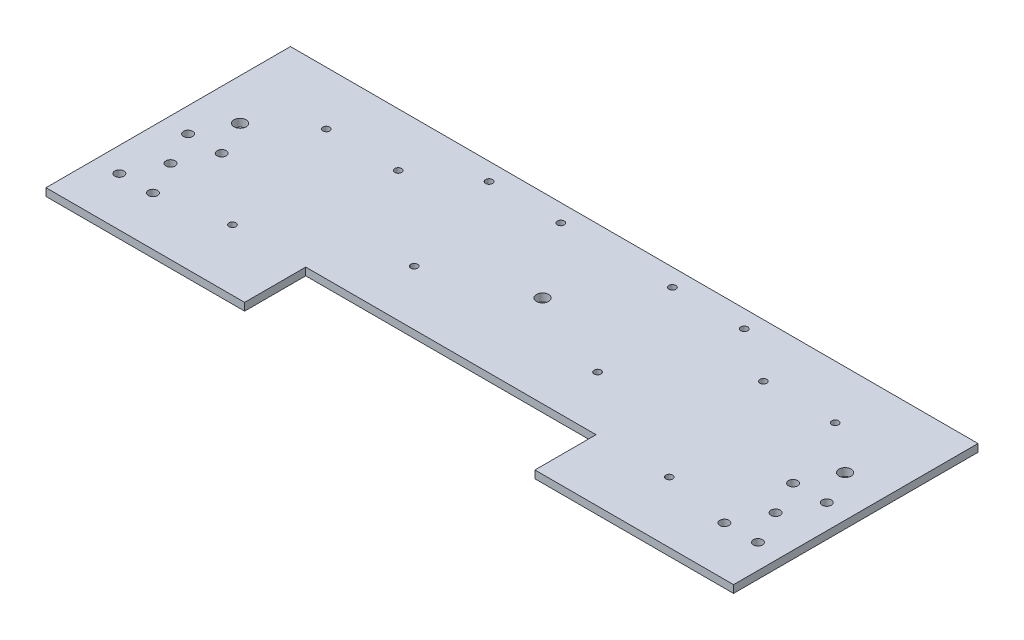
from build123d import *

# Parameters (mm, degrees)
SKETCH_1_W          = 450
SKETCH_1_H          = 120
EXTRUDE_1_DEPTH     = 5
SKETCH_2_R          = 4
CUT_EXTRUDE_1_DEPTH = 466.752079974
SKETCH_3_R          = 2.25
CUT_EXTRUDE_2_DEPTH = 466.752079974
SKETCH_4_W          = 130
SKETCH_4_H          = 40
EXTRUDE_2_DEPTH     = 5
SKETCH_5_R          = 2.25
CUT_EXTRUDE_3_DEPTH = 466.752079974
SKETCH_7_R          = 3
CUT_EXTRUDE_4_DEPTH = 466.752079974


with BuildPart() as part:
    # 草图1 → 凸台-拉伸1 (new body)
    with BuildSketch(Plane(origin=(0, 0, 0), x_dir=(1, 0, 0), z_dir=(0, 1, 0))):
        with Locations((225, 60)):
            Rectangle(SKETCH_1_W, SKETCH_1_H)
    extrude(amount=EXTRUDE_1_DEPTH)

    # 草图2 → 切除-拉伸1 (cut, through all)
    with BuildSketch(Plane(origin=(0, 5, 0), x_dir=(1, 0, 0), z_dir=(0, 1, 0))):
        with Locations(Location((225, 60, 0), (0, 0, 270))):
            Circle(SKETCH_2_R)
        with Locations(Location((27, 60, 0), (0, 0, 270))):
            Circle(SKETCH_2_R)
        with Locations(Location((423, 60, 0), (0, 0, 90))):
            Circle(SKETCH_2_R)
    extrude(amount=-CUT_EXTRUDE_1_DEPTH, mode=Mode.SUBTRACT)

    # 草图3 → 切除-拉伸2 (cut, through all)
    with BuildSketch(Plane(origin=(0, 5, 0), x_dir=(1, 0, 0), z_dir=(0, 1, 0))):
        with Locations(Location((165, 36, 0), (0, 0, 270))):
            Circle(SKETCH_3_R)
        with Locations(Location((141.5, 108.5, 0), (0, 0, 270))):
            Circle(SKETCH_3_R)
        with Locations(Location((188.5, 108.5, 0), (0, 0, 90))):
            Circle(SKETCH_3_R)
        with Locations(Location((285, 36, 0), (0, 0, 90))):
            Circle(SKETCH_3_R)
        with Locations(Location((261.5, 108.5, 0), (0, 0, 270))):
            Circle(SKETCH_3_R)
        with Locations(Location((308.5, 108.5, 0), (0, 0, 90))):
            Circle(SKETCH_3_R)
    extrude(amount=-CUT_EXTRUDE_2_DEPTH, mode=Mode.SUBTRACT)

    # 草图4 → 凸台-拉伸2 (add)
    with BuildSketch(Plane(origin=(0, 5, 0), x_dir=(1, 0, 0), z_dir=(0, 1, 0))):
        with Locations((65, -20)):
            Rectangle(SKETCH_4_W, SKETCH_4_H)
        with Locations((385, -20)):
            Rectangle(SKETCH_4_W, SKETCH_4_H)
    extrude(amount=-EXTRUDE_2_DEPTH)

    # 草图5 → 切除-拉伸3 (cut, through all)
    with BuildSketch(Plane(origin=(0, 5, 0), x_dir=(1, 0, 0), z_dir=(0, 1, 0))):
        with Locations(Location((82, 0, 0), (0, 0, 270))):
            Circle(SKETCH_5_R)
        with Locations(Location((58.5, 85, 0), (0, 0, 270))):
            Circle(SKETCH_5_R)
        with Locations(Location((105.5, 85, 0), (0, 0, 90))):
            Circle(SKETCH_5_R)
        with Locations(Location((368, 0, 0), (0, 0, 90))):
            Circle(SKETCH_5_R)
        with Locations(Location((344.5, 85, 0), (0, 0, 270))):
            Circle(SKETCH_5_R)
        with Locations(Location((391.5, 85, 0), (0, 0, 90))):
            Circle(SKETCH_5_R)
    extrude(amount=-CUT_EXTRUDE_3_DEPTH, mode=Mode.SUBTRACT)

    # 草图7 → 切除-拉伸4 (cut, through all)
    with BuildSketch(Plane(origin=(0, 5, 0), x_dir=(1, 0, 0), z_dir=(0, 1, 0))):
        with Locations(Location((38, 37, 0), (0, 0, 270))):
            Circle(SKETCH_7_R)
        with Locations(Location((16, 37, 0), (0, 0, 90))):
            Circle(SKETCH_7_R)
        with Locations(Location((16, -8, 0), (0, 0, 270))):
            Circle(SKETCH_7_R)
        with Locations(Location((38, -8, 0), (0, 0, 90))):
            Circle(SKETCH_7_R)
        with Locations(Location((27, 14.5, 0), (0, 0, 270))):
            Circle(SKETCH_7_R)
        with Locations(Location((412, 37, 0), (0, 0, 90))):
            Circle(SKETCH_7_R)
        with Locations(Location((434, 37, 0), (0, 0, 270))):
            Circle(SKETCH_7_R)
        with Locations(Location((434, -8, 0), (0, 0, 90))):
            Circle(SKETCH_7_R)
        with Locations(Location((423, 14.5, 0), (0, 0, 90))):
            Circle(SKETCH_7_R)
        with Locations(Location((412, -8, 0), (0, 0, 270))):
            Circle(SKETCH_7_R)
    extrude(amount=-CUT_EXTRUDE_4_DEPTH, mode=Mode.SUBTRACT)


solid = part.part
